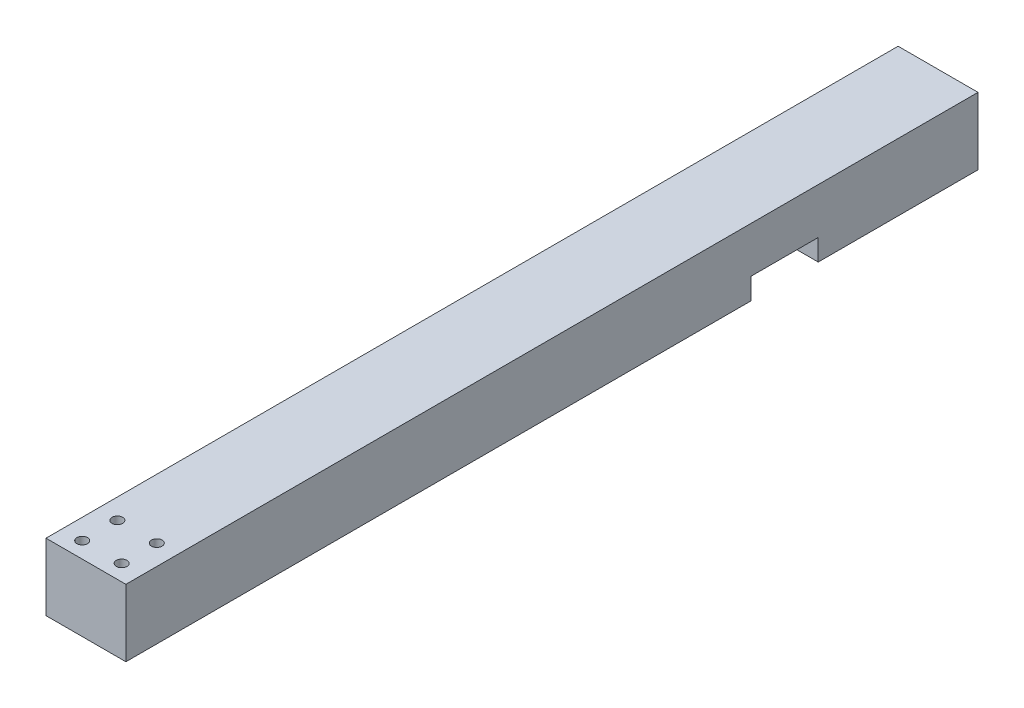
from build123d import *

# Parameters (mm, degrees)
ESQUISSE1_W             = 75
ESQUISSE1_H             = 63
BOSS_EXTRU_1_DEPTH      = 800
ESQUISSE2_R             = 5
ENL_V_MAT_EXTRU_1_DEPTH = 806.973944988
ESQUISSE3_W             = 75
ESQUISSE3_H             = 63
ENL_V_MAT_EXTRU_2_DEPTH = 20


with BuildPart() as part:
    # Esquisse1 → Boss.-Extru.1 (new body)
    with BuildSketch(Plane.XY):
        with Locations((37.5, 31.5)):
            Rectangle(ESQUISSE1_W, ESQUISSE1_H)
    extrude(amount=BOSS_EXTRU_1_DEPTH)

    # Esquisse2 → Enlèv. mat.-Extru.1 (cut, through all)
    with BuildSketch(Plane.XZ):
        with Locations(Location((19, 752, 0), (0, 0, 270))):
            Circle(ESQUISSE2_R)
        with Locations(Location((19, 785, 0), (0, 0, 270))):
            Circle(ESQUISSE2_R)
        with Locations(Location((56, 785, 0), (0, 0, 90))):
            Circle(ESQUISSE2_R)
        with Locations(Location((56, 752, 0), (0, 0, 90))):
            Circle(ESQUISSE2_R)
    extrude(amount=-ENL_V_MAT_EXTRU_1_DEPTH, mode=Mode.SUBTRACT)

    # Esquisse3 → Enlèv. mat.-Extru.2 (cut)
    with BuildSketch(Plane.XZ):
        with Locations((37.5, 181.5)):
            Rectangle(ESQUISSE3_W, ESQUISSE3_H)
    extrude(amount=-ENL_V_MAT_EXTRU_2_DEPTH, mode=Mode.SUBTRACT)


solid = part.part
